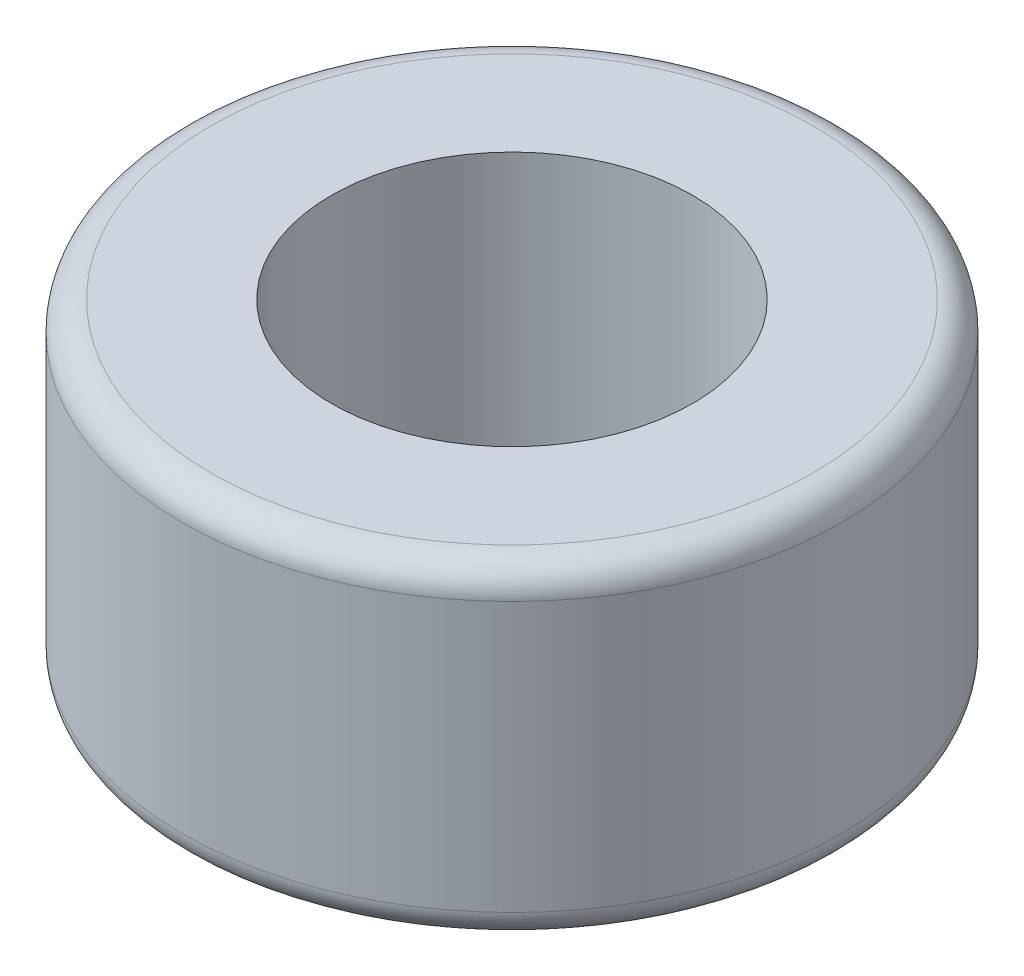
from build123d import *

# Parameters (mm, degrees)
SKETCH1_W = 2.6
SKETCH1_H = 5.7
FILLET1_R = 0.5


with BuildPart() as part:
    # Sketch1 → Revolve1 (revolve)
    with BuildSketch(Plane.XY, mode=Mode.PRIVATE) as revolve1_sk:
        with Locations((-4.45, 0)):
            Rectangle(SKETCH1_W, SKETCH1_H)
    revolve(revolve1_sk.sketch.rotate(Axis((0, 0, 0), (0, 1, 0)), 270), axis=Axis((0, 0, 0), (0, 1, 0)))

    # Fillet1
    fillet1_edges = [part.edges().sort_by_distance(p)[0] for p in [
        (0, 2.85, 5.75),
        (0, -2.85, 5.75),
    ]]
    fillet(fillet1_edges, radius=FILLET1_R)


solid = part.part
